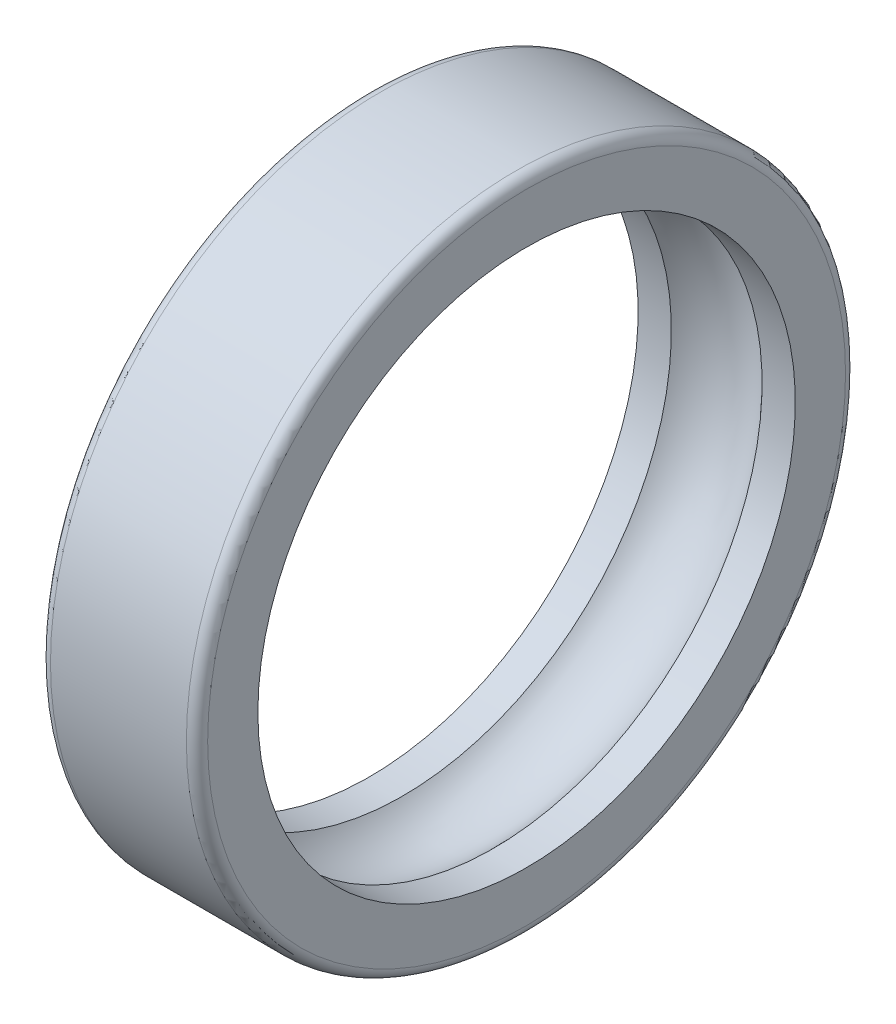
from build123d import *

# Parameters (mm, degrees)
FILLET1_R = 2.1


with BuildPart() as part:
    # Sketch1 → Revolve1 (revolve)
    with BuildSketch(Plane.XY, mode=Mode.PRIVATE) as revolve1_sk:
        with BuildLine():
            Line((-15.5, 65), (15.5, 65))
            Line((15.5, 65), (15.5, 53))
            Line((15.5, 53), (8.94427191, 53))
            ThreePointArc((8.94427191, 53), (0, 57), (-8.94427191, 53))
            Line((-8.94427191, 53), (-15.5, 53))
            Line((-15.5, 53), (-15.5, 65))
        make_face()
    revolve(revolve1_sk.sketch.rotate(Axis((-27.086278661, 0, 0), (1, 0, 0)), 90), axis=Axis((-27.086278661, 0, 0), (1, 0, 0)))

    # Fillet1
    fillet1_edges = [part.edges().sort_by_distance(p)[0] for p in [
        (15.5, 0, -65),
        (-15.5, 0, -65),
    ]]
    fillet(fillet1_edges, radius=FILLET1_R)


solid = part.part
